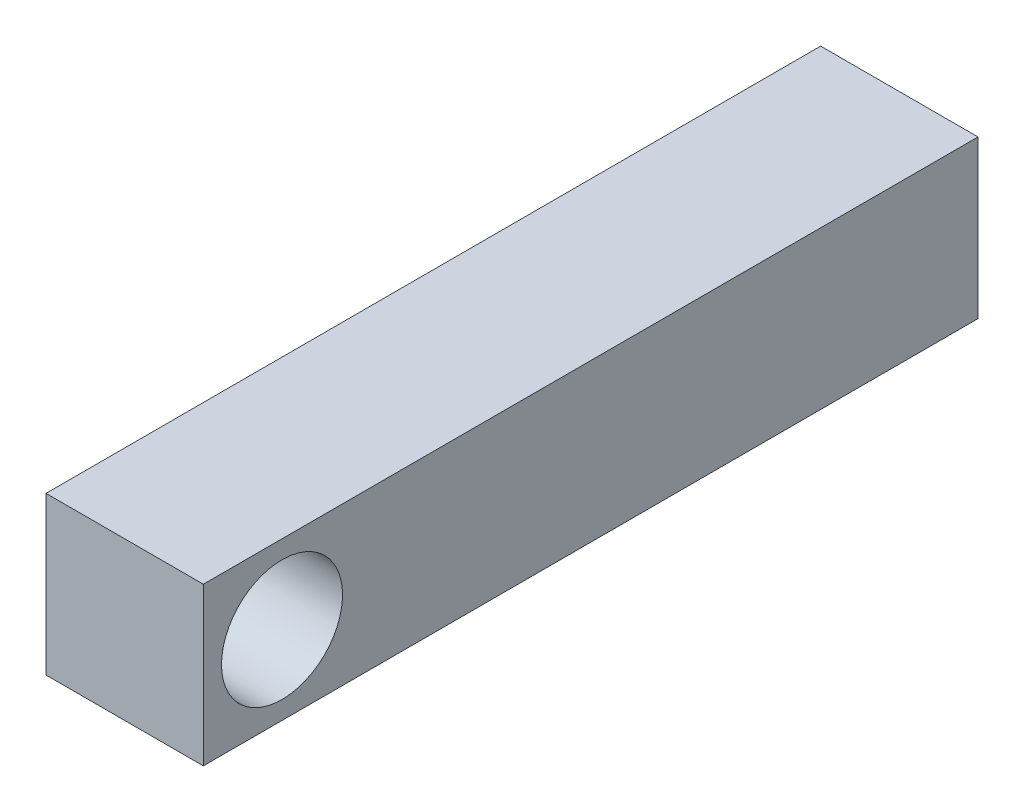
from build123d import *

# Parameters (mm, degrees)
SKETCH1_W           = 41.275
SKETCH1_H           = 41.275
BOSS_EXTRUDE1_DEPTH = 203.2
SKETCH3_R           = 15.875
CUT_EXTRUDE2_DEPTH  = 31.75
SKETCH4_R           = 15.875
CUT_EXTRUDE3_DEPTH  = 209.37411555


with BuildPart() as part:
    # Sketch1 → Boss-Extrude1 (new body)
    with BuildSketch(Plane.XY):
        Rectangle(SKETCH1_W, SKETCH1_H)
    extrude(amount=BOSS_EXTRUDE1_DEPTH)

    # Sketch3 → Cut-Extrude2 (cut)
    with BuildSketch(Plane.XZ.offset(20.6375)):
        with Locations(Location((0, 20.6375, 0), (0, 0, 270))):
            Circle(SKETCH3_R)
    extrude(amount=-CUT_EXTRUDE2_DEPTH, mode=Mode.SUBTRACT)

    # Sketch4 → Cut-Extrude3 (cut, through all)
    with BuildSketch(Plane.ZY.offset(20.6375)):
        with Locations((182.5625, 0)):
            Circle(SKETCH4_R)
    extrude(amount=-CUT_EXTRUDE3_DEPTH, mode=Mode.SUBTRACT)


solid = part.part
